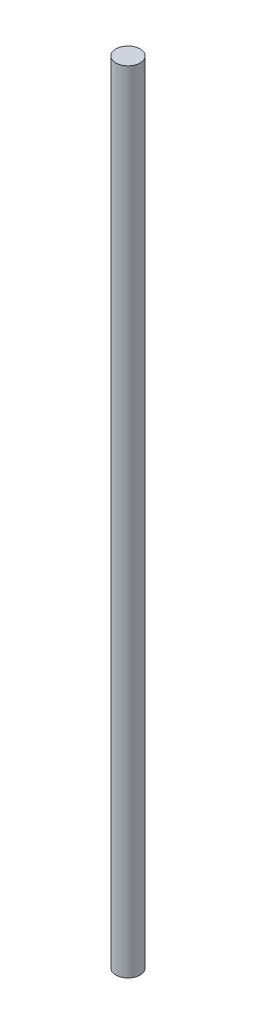
from build123d import *

# Parameters (mm, degrees)
ESQUISSE1_R        = 20
BOSS_EXTRU_1_DEPTH = 1300


with BuildPart() as part:
    # Esquisse1 → Boss.-Extru.1 (new body)
    with BuildSketch(Plane(origin=(0, 0, 0), x_dir=(1, 0, 0), z_dir=(0, 1, 0))):
        with Locations(Location((0, 0, 0), (0, 0, 270))):
            Circle(ESQUISSE1_R)
    extrude(amount=BOSS_EXTRU_1_DEPTH)


solid = part.part
